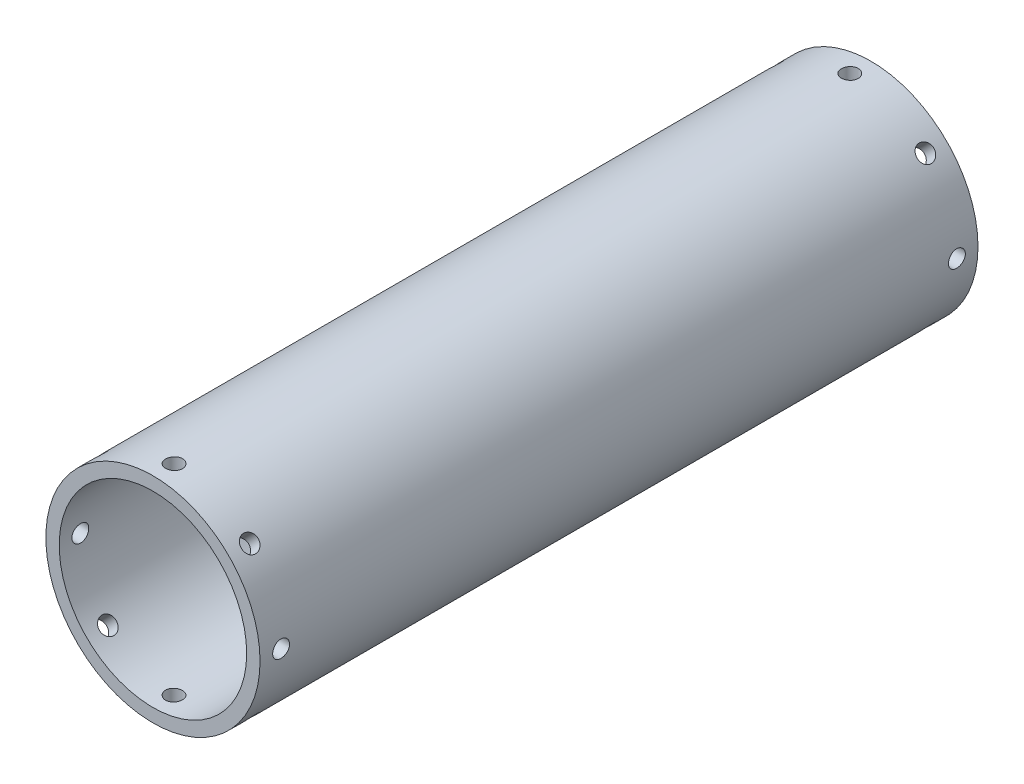
from build123d import *

# Parameters (mm, degrees)
ESBO_O1_R                = 25.4
ESBO_O1_R_2              = 22.23
RESSALTO_EXTRUS_O1_DEPTH = 170.27
CORTE_EXTRUS_O1_REACH    = 181.493
ESBO_O3_R                = 2
PADR_OCIRCULAR1_COUNT    = 8
CORTE_EXTRUS_O2_REACH    = 181.493
ESBO_O4_R                = 2
PADR_OCIRCULAR2_COUNT    = 8


with BuildPart() as part:
    # Esboço1 → Ressalto-extrusão1 (new body)
    with BuildSketch(Plane.XY):
        Circle(ESBO_O1_R)
        Circle(ESBO_O1_R_2, mode=Mode.SUBTRACT)
    extrude(amount=RESSALTO_EXTRUS_O1_DEPTH)

    # Esboço3 → Corte-extrusão1 (cut, up to next)
    with BuildSketch(Plane(origin=(0, 25.4, 0), x_dir=(1, 0, 0), z_dir=(0, 1, 0)), mode=Mode.PRIVATE) as corte_extrus_o1_sk1:
        with Locations((0, -165.27)):
            Circle(ESBO_O3_R)
    corte_extrus_o1_tool1 = extrude(corte_extrus_o1_sk1.sketch, amount=-CORTE_EXTRUS_O1_REACH, mode=Mode.PRIVATE) & part.part
    corte_extrus_o1 = corte_extrus_o1_tool1.solids().sort_by_distance((0, 25.4, 165.27))[0]
    add(corte_extrus_o1, mode=Mode.SUBTRACT)

    # PadrãoCircular1: Corte-extrusão1 ×8 about axis
    padr_ocircular1_axis = Axis((0, 0, 170.27), (0, 0, 1))
    for i in range(1, PADR_OCIRCULAR1_COUNT):
        add(corte_extrus_o1.rotate(padr_ocircular1_axis, i * 360 / PADR_OCIRCULAR1_COUNT), mode=Mode.SUBTRACT)

    # Esboço4 → Corte-extrusão2 (cut, up to next)
    with BuildSketch(Plane(origin=(0, 25.4, 0), x_dir=(1, 0, 0), z_dir=(0, 1, 0)), mode=Mode.PRIVATE) as corte_extrus_o2_sk1:
        with Locations((-0.017770346, -5)):
            Circle(ESBO_O4_R)
    corte_extrus_o2_tool1 = extrude(corte_extrus_o2_sk1.sketch, amount=-CORTE_EXTRUS_O2_REACH, mode=Mode.PRIVATE) & part.part
    corte_extrus_o2 = corte_extrus_o2_tool1.solids().sort_by_distance((-0.01777, 25.4, 5))[0]
    add(corte_extrus_o2, mode=Mode.SUBTRACT)

    # PadrãoCircular2: Corte-extrusão2 ×8 about axis
    padr_ocircular2_axis = Axis((0, 0, 0), (0, 0, 1))
    for i in range(1, PADR_OCIRCULAR2_COUNT):
        add(corte_extrus_o2.rotate(padr_ocircular2_axis, i * 360 / PADR_OCIRCULAR2_COUNT), mode=Mode.SUBTRACT)


solid = part.part
